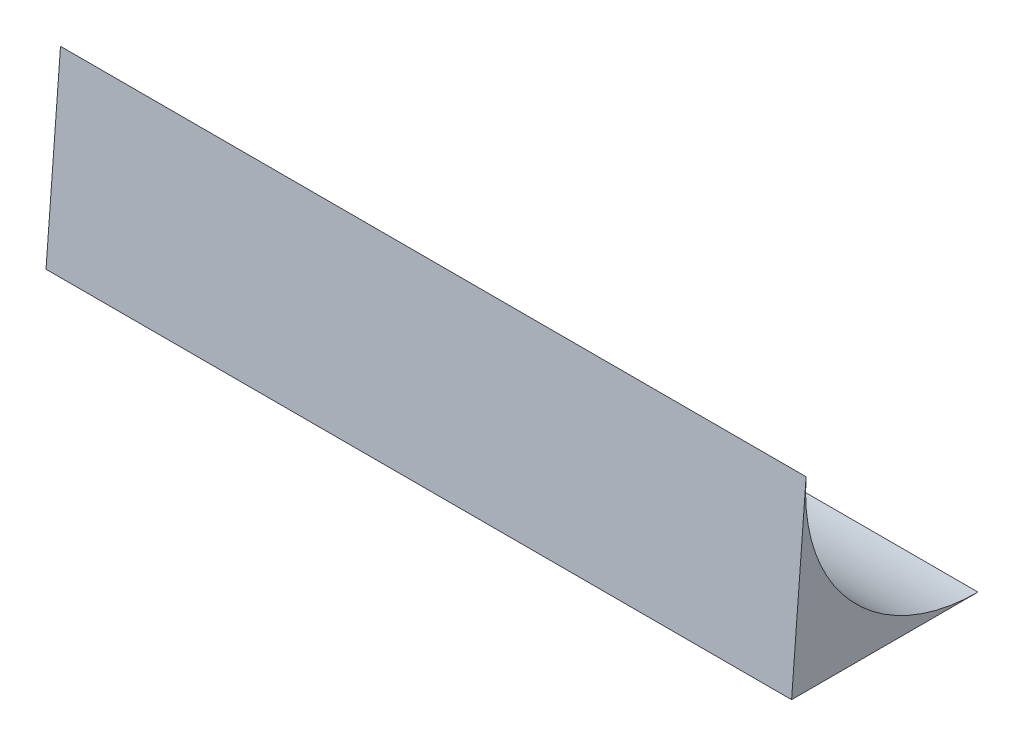
from build123d import *

# Parameters (mm, degrees)
BOSS_EXTRUDE1_DEPTH = 40


with BuildPart() as part:
    # Sketch1 → Boss-Extrude1 (new body)
    with BuildSketch(Plane(origin=(0, 0, 0), x_dir=(0, 0, -1), z_dir=(1, 0, 0))):
        with BuildLine():
            Line((0, 0), (10, 0))
            ThreePointArc((10, 0), (3.209580184, 2.96886167), (0.778039744, 9.969686763))
            Line((0.778039744, 9.969686763), (0, 0))
        make_face()
    extrude(amount=BOSS_EXTRUDE1_DEPTH)


solid = part.part
